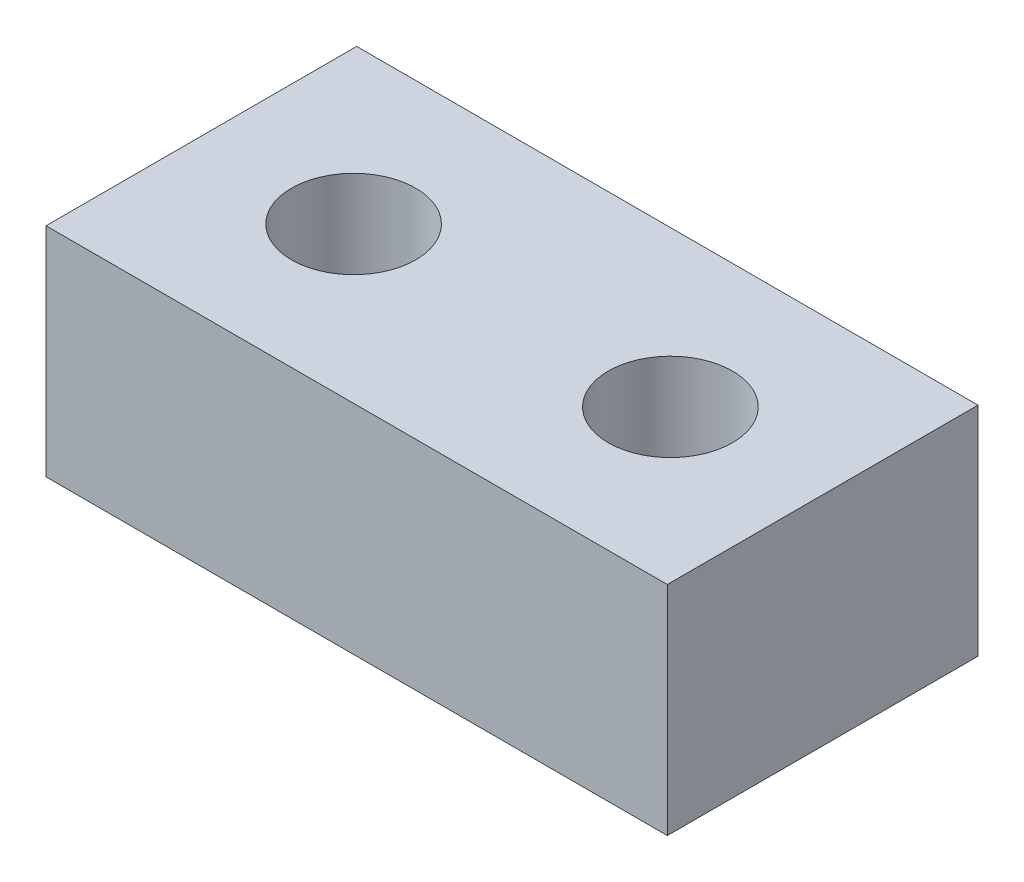
from build123d import *

# Parameters (mm, degrees)
SKETCH_1_W          = 200
SKETCH_1_H          = 100
EXTRUDE_1_DEPTH     = 70
SKETCH_3_R          = 20
CUT_EXTRUDE_1_DEPTH = 40
SKETCH_3_3_R        = 20
CUT_EXTRUDE_2_DEPTH = 40


with BuildPart() as part:
    # Эскиз1 → Бобышка-Вытянуть1 (new body)
    with BuildSketch(Plane(origin=(0, 0, 0), x_dir=(1, 0, 0), z_dir=(0, 1, 0))):
        with Locations((100, 50)):
            Rectangle(SKETCH_1_W, SKETCH_1_H)
    extrude(amount=-EXTRUDE_1_DEPTH)

    # Эскиз3 → Вырез-Вытянуть1 (cut)
    with BuildSketch(Plane(origin=(0, 0, 0), x_dir=(1, 0, 0), z_dir=(0, 1, 0))):
        with Locations((49.017273864, 50)):
            Circle(SKETCH_3_R)
    extrude(amount=-CUT_EXTRUDE_1_DEPTH, mode=Mode.SUBTRACT)

    # Эскиз3<3> → Вырез-Вытянуть2 (cut)
    with BuildSketch(Plane(origin=(0, 0, 0), x_dir=(1, 0, 0), z_dir=(0, 1, 0))):
        with Locations((150.982726136, 50)):
            Circle(SKETCH_3_3_R)
    extrude(amount=-CUT_EXTRUDE_2_DEPTH, mode=Mode.SUBTRACT)


solid = part.part
